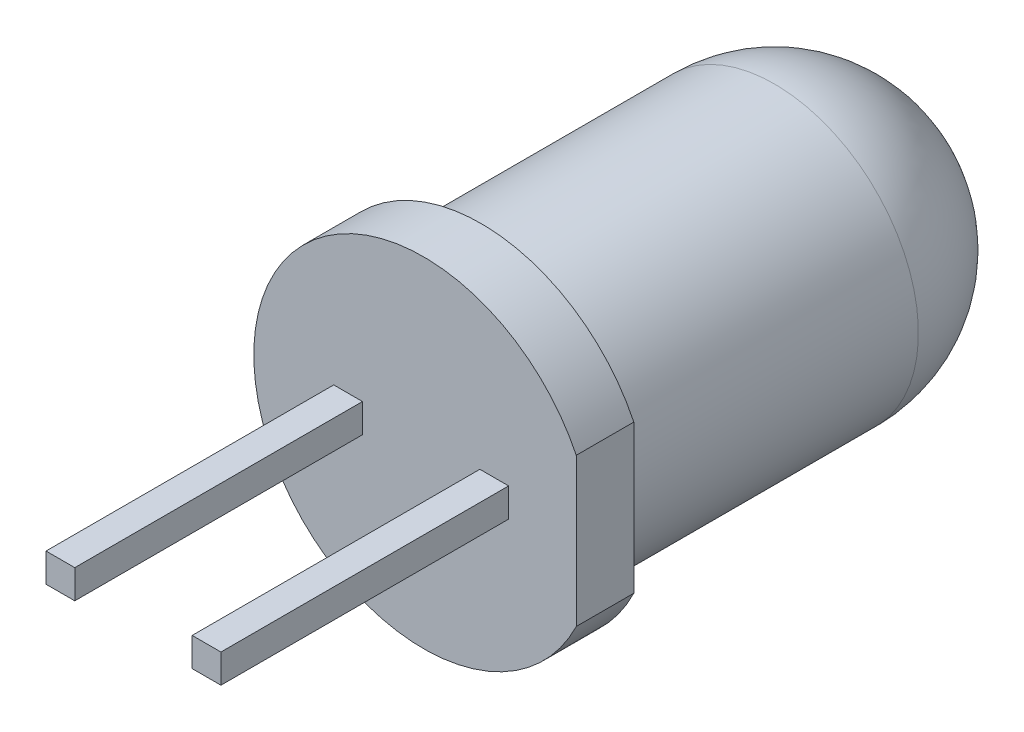
from build123d import *

# Parameters (mm, degrees)
SKETCH2_W           = 0.5
SKETCH2_H           = 0.5
BOSS_EXTRUDE1_DEPTH = 5
CUT_EXTRUDE1_REACH  = 11.565


with BuildPart() as part:
    # Sketch1 → Revolve3 (revolve)
    with BuildSketch(Plane(origin=(0, 0, 0), x_dir=(1, 0, 0), z_dir=(0, 1, 0))):
        with BuildLine():
            Line((0.041424419, -1.31875), (-2.908575581, -1.31875))
            Line((-2.908575581, -1.31875), (-2.908575581, -0.31875))
            Line((-2.908575581, -0.31875), (-2.458575581, -0.31875))
            Line((-2.458575581, -0.31875), (-2.458575581, 4.78125))
            ThreePointArc((-2.458575581, 4.78125), (-1.726342534, 6.549016953), (0.041424419, 7.28125))
            Line((0.041424419, 7.28125), (0.041424419, 6.960699472))
            Line((0.041424419, 6.960699472), (-0.258575581, 6.960699472))
            ThreePointArc((-0.258575581, 6.960699472), (-1.616887977, 6.226933229), (-2.158575581, 4.78125))
            Line((-2.158575581, 4.78125), (-2.158575581, -0.61875))
            Line((-2.158575581, -0.61875), (-2.608575581, -0.61875))
            Line((-2.608575581, -0.61875), (-2.608575581, -1.01875))
            Line((-2.608575581, -1.01875), (-0.258575581, -1.01875))
            Line((-0.258575581, -1.01875), (0.041424419, -1.01875))
            Line((0.041424419, -1.01875), (0.041424419, -1.31875))
        make_face()
    revolve(axis=Axis((0.041424419, 0, -7.28125), (0, 0, 1)))

    # Sketch2 → Boss-Extrude1 (add)
    with BuildSketch(Plane.XY.offset(1.31875)):
        with Locations((1.27, -0.01024953)):
            Rectangle(SKETCH2_W, SKETCH2_H)
        with Locations((-1.27, -0.01024953)):
            Rectangle(SKETCH2_W, SKETCH2_H)
    extrude(amount=BOSS_EXTRUDE1_DEPTH)

    # Sketch3 → Cut-Extrude1 (cut, up to next)
    with BuildSketch(Plane(origin=(0.020061741, 0, 1.31875), x_dir=(1, 0, 0), z_dir=(0, 0, 1)), mode=Mode.PRIVATE) as cut_extrude1_sk1:
        Polygon((2.675232006, 2.192680339), (2.675232006, -2.268878516), (4.29481628, -2.502381421), (4.160489908, 2.299424082), align=None)
    cut_extrude1_tool1 = extrude(cut_extrude1_sk1.sketch, amount=-CUT_EXTRUDE1_REACH, mode=Mode.PRIVATE) & part.part
    add(cut_extrude1_tool1.solids().sort_by_distance((3.481327, -0.10236, 1.31875))[0], mode=Mode.SUBTRACT)


solid = part.part
